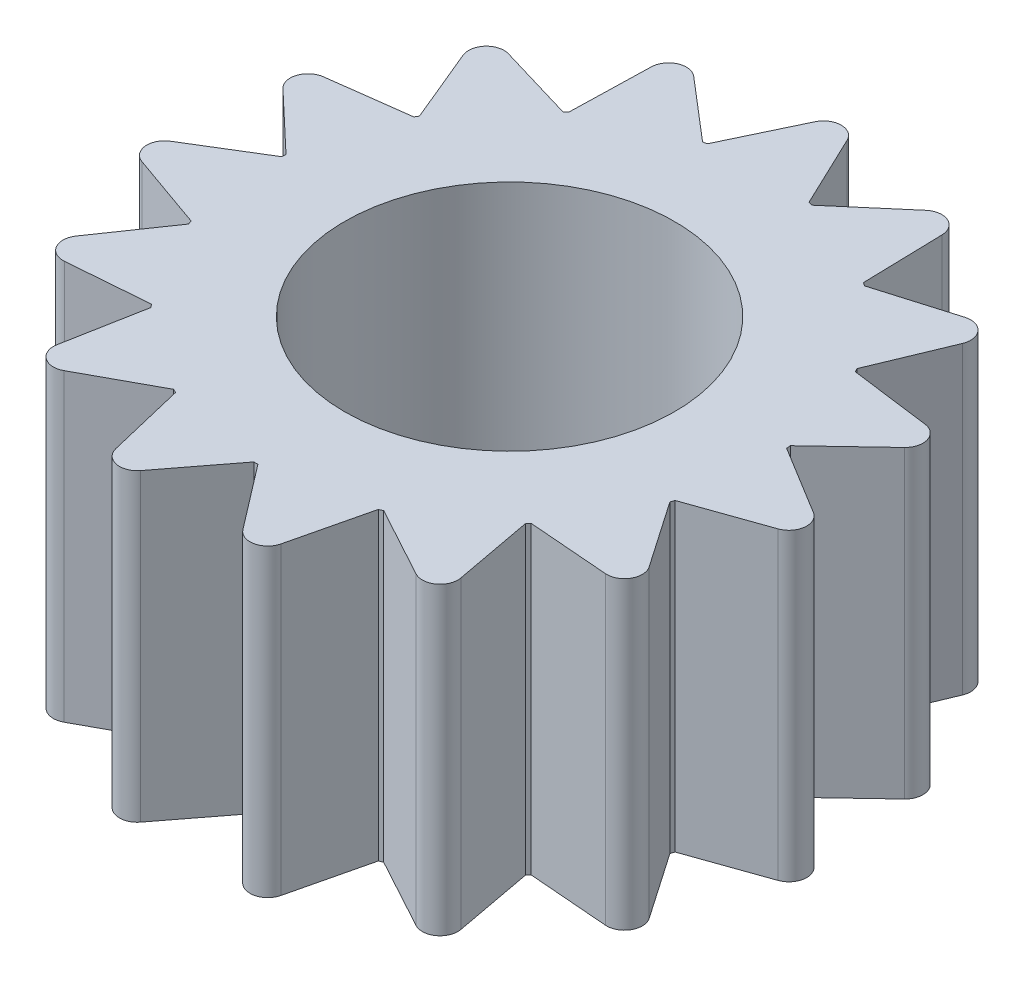
from build123d import *

# Parameters (mm, degrees)
SKETCH1_R           = 3.25
BOSS_EXTRUDE2_DEPTH = 6
FILLET1_R           = 0.35


with BuildPart() as part:
    # Sketch1 → Boss-Extrude2 (new body)
    with BuildSketch(Plane(origin=(0, 0, 0), x_dir=(1, 0, 0), z_dir=(0, 1, 0))):
        with BuildLine():
            Line((1, 4.898979486), (0, 7))
            Line((0, 7), (-1, 4.898979486))
            ThreePointArc((-1, 4.898979486), (-1.039558454, 4.890738004), (-1.079049013, 4.882177099))
            Line((-1.079049013, 4.882177099), (-2.847156502, 6.394818203))
            Line((-2.847156502, 6.394818203), (-2.906139928, 4.068703813))
            ThreePointArc((-2.906139928, 4.068703813), (-2.938926261, 4.045084972), (-2.971520648, 4.021201939))
            Line((-2.971520648, 4.021201939), (-5.202013778, 4.683914245))
            Line((-5.202013778, 4.683914245), (-4.309781861, 2.534912288))
            ThreePointArc((-4.309781861, 2.534912288), (-4.330127019, 2.5), (-4.350189369, 2.464924432))
            Line((-4.350189369, 2.464924432), (-6.657395614, 2.163118961))
            Line((-6.657395614, 2.163118961), (-4.968223357, 0.5628114))
            ThreePointArc((-4.968223357, 0.5628114), (-4.972609477, 0.522642316), (-4.976670827, 0.482439098))
            Line((-4.976670827, 0.482439098), (-6.961653268, -0.731699243))
            Line((-6.961653268, -0.731699243), (-4.7676139, -1.506604693))
            ThreePointArc((-4.7676139, -1.506604693), (-4.755282581, -1.545084972), (-4.742640687, -1.583464339))
            Line((-4.742640687, -1.583464339), (-6.062177826, -3.5))
            Line((-6.062177826, -3.5), (-3.742640687, -3.315515147))
            ThreePointArc((-3.742640687, -3.315515147), (-3.715724127, -3.345653032), (-3.688564887, -3.375572407))
            Line((-3.688564887, -3.375572407), (-4.114496766, -5.663118961))
            Line((-4.114496766, -5.663118961), (-2.070530899, -4.551142911))
            ThreePointArc((-2.070530899, -4.551142911), (-2.033683215, -4.567727288), (-1.996702709, -4.584013339))
            Line((-1.996702709, -4.584013339), (-1.455381836, -6.847033205))
            Line((-1.455381836, -6.847033205), (-0.040407507, -4.999836721))
            ThreePointArc((-0.040407507, -4.999836721), (0, -5), (0.040407507, -4.999836721))
            Line((0.040407507, -4.999836721), (1.455381836, -6.847033205))
            Line((1.455381836, -6.847033205), (1.996702709, -4.584013339))
            ThreePointArc((1.996702709, -4.584013339), (2.033683215, -4.567727288), (2.070530899, -4.551142911))
            Line((2.070530899, -4.551142911), (4.114496766, -5.663118961))
            Line((4.114496766, -5.663118961), (3.688564887, -3.375572407))
            ThreePointArc((3.688564887, -3.375572407), (3.715724127, -3.345653032), (3.742640687, -3.315515147))
            Line((3.742640687, -3.315515147), (6.062177826, -3.5))
            Line((6.062177826, -3.5), (4.742640687, -1.583464339))
            ThreePointArc((4.742640687, -1.583464339), (4.755282581, -1.545084972), (4.7676139, -1.506604693))
            Line((4.7676139, -1.506604693), (6.961653268, -0.731699243))
            Line((6.961653268, -0.731699243), (4.976670827, 0.482439098))
            ThreePointArc((4.976670827, 0.482439098), (4.972609477, 0.522642316), (4.968223357, 0.5628114))
            Line((4.968223357, 0.5628114), (6.657395614, 2.163118961))
            Line((6.657395614, 2.163118961), (4.350189369, 2.464924432))
            ThreePointArc((4.350189369, 2.464924432), (4.330127019, 2.5), (4.309781861, 2.534912288))
            Line((4.309781861, 2.534912288), (5.202013778, 4.683914245))
            Line((5.202013778, 4.683914245), (2.971520648, 4.021201939))
            ThreePointArc((2.971520648, 4.021201939), (2.938926261, 4.045084972), (2.906139928, 4.068703813))
            Line((2.906139928, 4.068703813), (2.847156502, 6.394818203))
            Line((2.847156502, 6.394818203), (1.079049013, 4.882177099))
            ThreePointArc((1.079049013, 4.882177099), (1.039558454, 4.890738004), (1, 4.898979486))
        make_face()
        with Locations(Location((0, 0, 0), (0, 0, 270))):
            Circle(SKETCH1_R, mode=Mode.SUBTRACT)
    extrude(amount=BOSS_EXTRUDE2_DEPTH)

    # Fillet1
    fillet1_edges = [part.edges().sort_by_distance(p)[0] for p in [
        (2.847156502, 3, -6.394818203),
        (5.202013778, 3, -4.683914245),
        (6.657395614, 3, -2.163118961),
        (6.961653268, 3, 0.731699243),
        (6.062177826, 3, 3.5),
        (4.114496766, 3, 5.663118961),
        (1.455381836, 3, 6.847033205),
        (-1.455381836, 3, 6.847033205),
        (-4.114496766, 3, 5.663118961),
        (-6.062177826, 3, 3.5),
        (-6.961653268, 3, 0.731699243),
        (-6.657395614, 3, -2.163118961),
        (-5.202013778, 3, -4.683914245),
        (-2.847156502, 3, -6.394818203),
        (0, 3, -7),
    ]]
    fillet(fillet1_edges, radius=FILLET1_R)


solid = part.part
